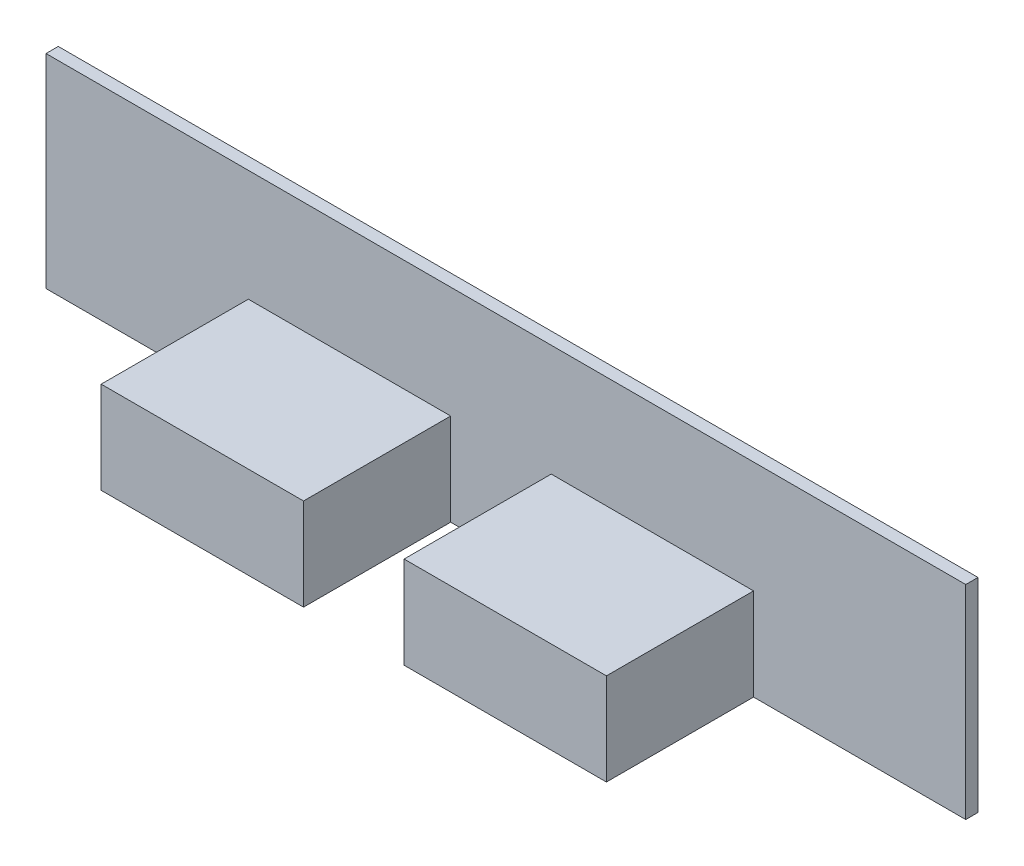
from build123d import *

# Parameters (mm, degrees)
SKETCH1_W           = 190.5
SKETCH1_H           = 42.164
BOSS_EXTRUDE1_DEPTH = 2.54
SKETCH1_3_W         = 41.91
SKETCH1_3_H         = 19.05
BOSS_EXTRUDE2_DEPTH = 30.48


with BuildPart() as part:
    # Sketch1 → Boss-Extrude1 (new body)
    with BuildSketch(Plane.XY):
        with Locations((95.25, 21.082)):
            Rectangle(SKETCH1_W, SKETCH1_H)
    extrude(amount=-BOSS_EXTRUDE1_DEPTH)

    # Sketch1<3> → Boss-Extrude2 (add)
    with BuildSketch(Plane.XY):
        with Locations((62.865, 9.525)):
            Rectangle(SKETCH1_3_W, SKETCH1_3_H)
        with Locations((125.603, 9.525)):
            Rectangle(SKETCH1_3_W, SKETCH1_3_H)
    extrude(amount=BOSS_EXTRUDE2_DEPTH)


solid = part.part
